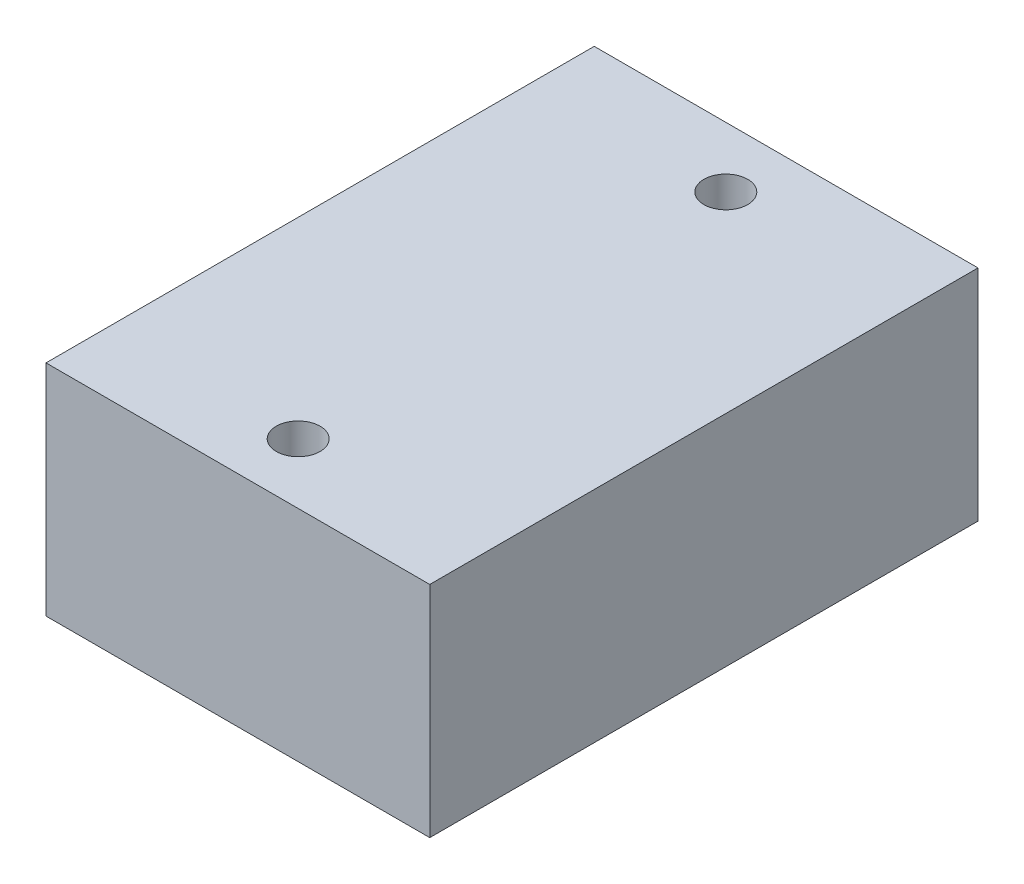
from build123d import *

# Parameters (mm, degrees)
SKETCH_1_W      = 35
SKETCH_1_H      = 50
SKETCH_1_R      = 2
EXTRUDE_1_DEPTH = 20


with BuildPart() as part:
    # 草图1 → 凸台-拉伸1 (new body)
    with BuildSketch(Plane(origin=(0, 0, 0), x_dir=(1, 0, 0), z_dir=(0, 1, 0))):
        Rectangle(SKETCH_1_W, SKETCH_1_H)
        with Locations(Location((0, 19.5, 0), (0, 0, 270))):
            Circle(SKETCH_1_R, mode=Mode.SUBTRACT)
        with Locations(Location((0, -19.5, 0), (0, 0, 270))):
            Circle(SKETCH_1_R, mode=Mode.SUBTRACT)
    extrude(amount=EXTRUDE_1_DEPTH)


solid = part.part
